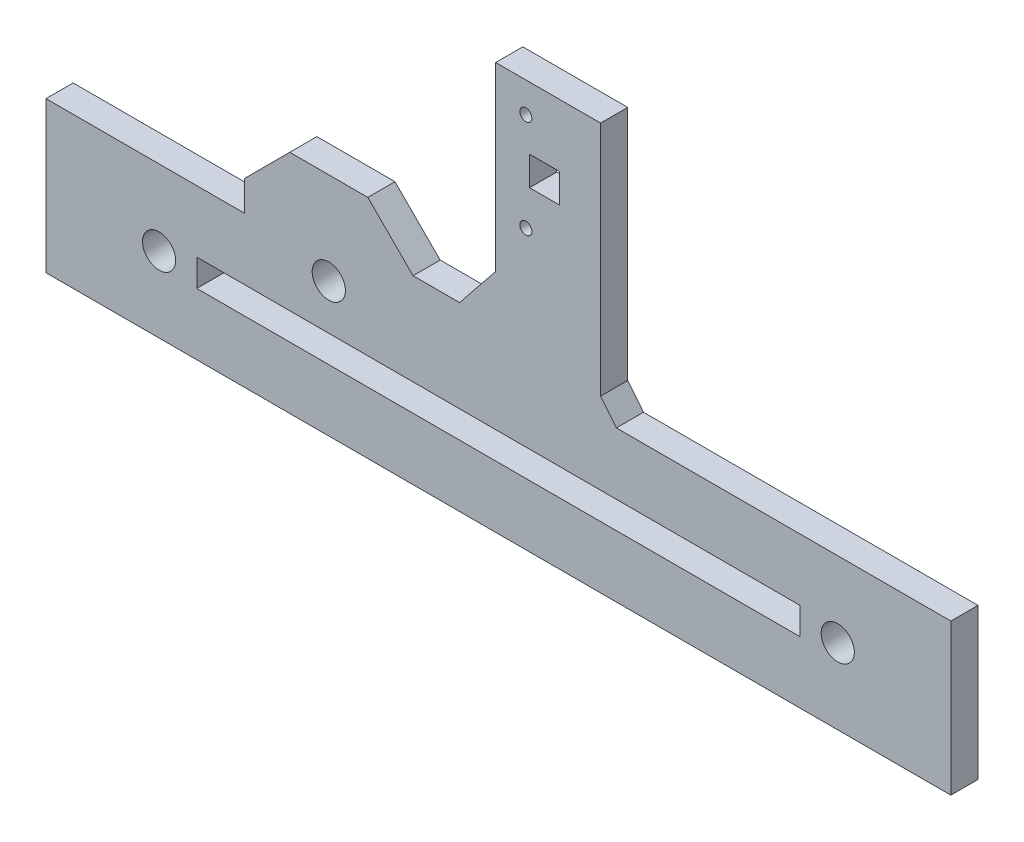
from build123d import *

# Parameters (mm, degrees)
SCHIZZO1_W                   = 600
SCHIZZO1_H                   = 100
ESTRUSIONE_ESTRUSIONE1_DEPTH = 18
SCHIZZO2_W                   = 400
SCHIZZO2_H                   = 18
TAGLIO_ESTRUSIONE1_DEPTH     = 18
SCHIZZO3_R                   = 11
TAGLIO_ESTRUSIONE2_DEPTH     = 18
SCHIZZO7_W                   = 111.74591768
SCHIZZO7_H                   = 50
ESTRUSIONE_ESTRUSIONE2_DEPTH = 18
SCHIZZO4_R                   = 11
TAGLIO_ESTRUSIONE4_DEPTH     = 18
SMUSSO1_SIZE                 = 30
SCHIZZO9_R                   = 4
ESTRUSIONE_ESTRUSIONE3_DEPTH = 18
ESTRUSIONE_ESTRUSIONE4_DEPTH = 18
SCHIZZO15_W                  = 19.88
SCHIZZO15_H                  = 19.28
TAGLIO_ESTRUSIONE7_DEPTH     = 20


with BuildPart() as part:
    # Schizzo1 → Estrusione-Estrusione1 (new body)
    with BuildSketch(Plane.XY):
        Rectangle(SCHIZZO1_W, SCHIZZO1_H)
    extrude(amount=ESTRUSIONE_ESTRUSIONE1_DEPTH)

    # Schizzo2 → Taglio-Estrusione1 (cut)
    with BuildSketch(Plane.XY.offset(18)):
        Rectangle(SCHIZZO2_W, SCHIZZO2_H)
    extrude(amount=-TAGLIO_ESTRUSIONE1_DEPTH, mode=Mode.SUBTRACT)

    # Schizzo3 → Taglio-Estrusione2 (cut)
    with BuildSketch(Plane.XY.offset(18)):
        with Locations((-225, 0)):
            Circle(SCHIZZO3_R)
    taglio_estrusione2 = extrude(amount=-TAGLIO_ESTRUSIONE2_DEPTH, mode=Mode.SUBTRACT)

    # Specchia1: Taglio-Estrusione2 across plane
    add(taglio_estrusione2.mirror(Plane(origin=(0, 0, 0), x_dir=(0, 0, 1), z_dir=(1, 0, 0))), mode=Mode.SUBTRACT)

    # Schizzo7 → Estrusione-Estrusione2 (add)
    with BuildSketch(Plane.XY.offset(18)):
        with Locations((-112.480128411, 75)):
            Rectangle(SCHIZZO7_W, SCHIZZO7_H)
    extrude(amount=-ESTRUSIONE_ESTRUSIONE2_DEPTH)

    # Schizzo4 → Taglio-Estrusione4 (cut)
    with BuildSketch(Plane.XY.offset(18)):
        with Locations((-112.480128411, 39)):
            Circle(SCHIZZO4_R)
    extrude(amount=-TAGLIO_ESTRUSIONE4_DEPTH, mode=Mode.SUBTRACT)

    # Smusso1
    smusso1_edges = [part.edges().sort_by_distance(p)[0] for p in [
        (-168.353087251, 100, 9),
        (-56.607169571, 100, 9),
    ]]
    chamfer(smusso1_edges, length=SMUSSO1_SIZE)

    # Schizzo9 → Estrusione-Estrusione3 (add)
    with BuildSketch(Plane.XY.offset(18)):
        Polygon((-1.816869292, 219.840422), (-1.816869292, 99.840422), (-41.816869292, 50), (78.183130708, 50), (67.739440982, 63.012947579), (67.739440982, 219.840422), align=None)
        with Locations((18.183130708, 199.840422)):
            Circle(SCHIZZO9_R, mode=Mode.SUBTRACT)
        with Locations((18.183130708, 134.750422)):
            Circle(SCHIZZO9_R, mode=Mode.SUBTRACT)
    extrude(amount=-ESTRUSIONE_ESTRUSIONE3_DEPTH)

    # Schizzo10 → Estrusione-Estrusione4 (add)
    with BuildSketch(Plane.XY.offset(18)):
        Polygon((-56.607169571, 70), (-25.765640833, 70), (-41.816869292, 50), (-56.607169571, 50), align=None)
    extrude(amount=-ESTRUSIONE_ESTRUSIONE4_DEPTH)

    # Schizzo15 → Taglio-Estrusione7 (cut)
    with BuildSketch(Plane.XY.offset(18)):
        with Locations((30.563130708, 168.790422)):
            Rectangle(SCHIZZO15_W, SCHIZZO15_H)
    extrude(amount=-TAGLIO_ESTRUSIONE7_DEPTH, mode=Mode.SUBTRACT)


solid = part.part
